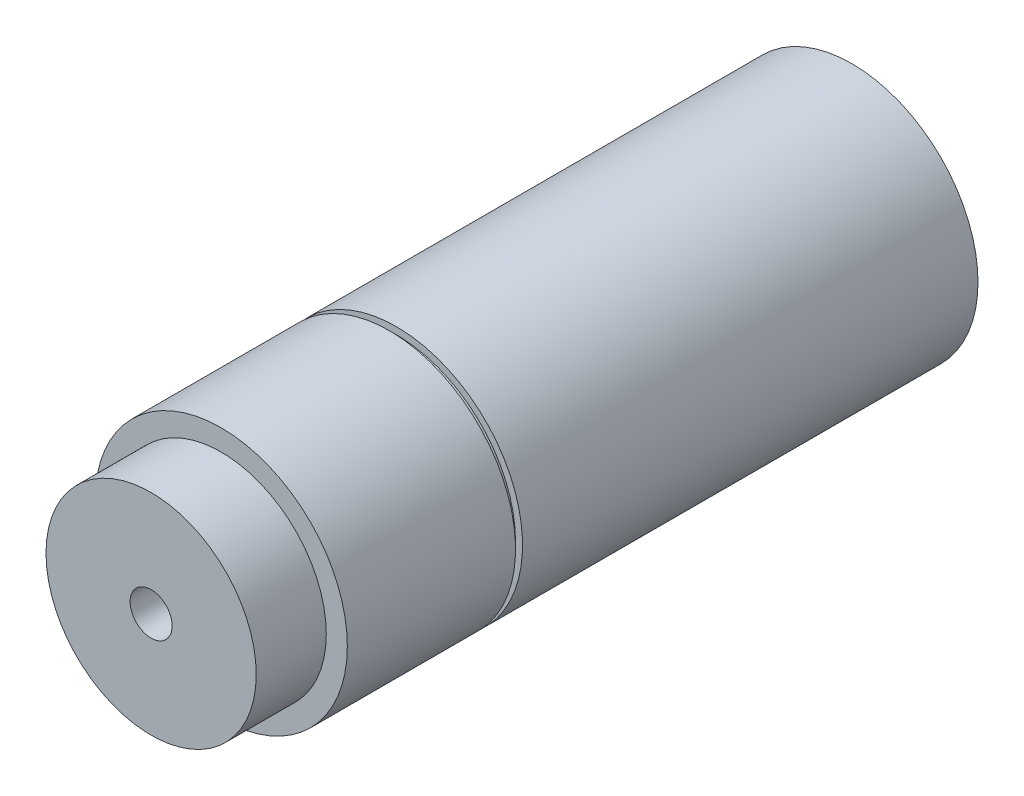
from build123d import *

# Parameters (mm, degrees)
SKETCH1_R           = 18
BOSS_EXTRUDE1_DEPTH = 100
SKETCH2_R           = 25
SKETCH2_R_2         = 15
CUT_EXTRUDE2_DEPTH  = 10
SKETCH4_R           = 3
CUT_EXTRUDE3_DEPTH  = 100
SKETCH5_R           = 18
SKETCH5_R_2         = 17
CUT_EXTRUDE4_DEPTH  = 1


with BuildPart() as part:
    # Sketch1 → Boss-Extrude1 (new body)
    with BuildSketch(Plane.XY):
        Circle(SKETCH1_R)
    extrude(amount=BOSS_EXTRUDE1_DEPTH)

    # Sketch2 → Cut-Extrude2 (cut)
    with BuildSketch(Plane.XY.offset(100)):
        Circle(SKETCH2_R)
        Circle(SKETCH2_R_2, mode=Mode.SUBTRACT)
    extrude(amount=-CUT_EXTRUDE2_DEPTH, mode=Mode.SUBTRACT)

    # Sketch4 → Cut-Extrude3 (cut)
    with BuildSketch(Plane.XY.offset(100)):
        Circle(SKETCH4_R)
    extrude(amount=-CUT_EXTRUDE3_DEPTH, mode=Mode.SUBTRACT)

    # Sketch5 → Cut-Extrude4 (cut)
    with BuildSketch(Plane(origin=(0, 0, 65), x_dir=(-1, 0, 0), z_dir=(0, 0, -1))):
        Circle(SKETCH5_R)
        Circle(SKETCH5_R_2, mode=Mode.SUBTRACT)
    extrude(amount=-CUT_EXTRUDE4_DEPTH, mode=Mode.SUBTRACT)


solid = part.part
